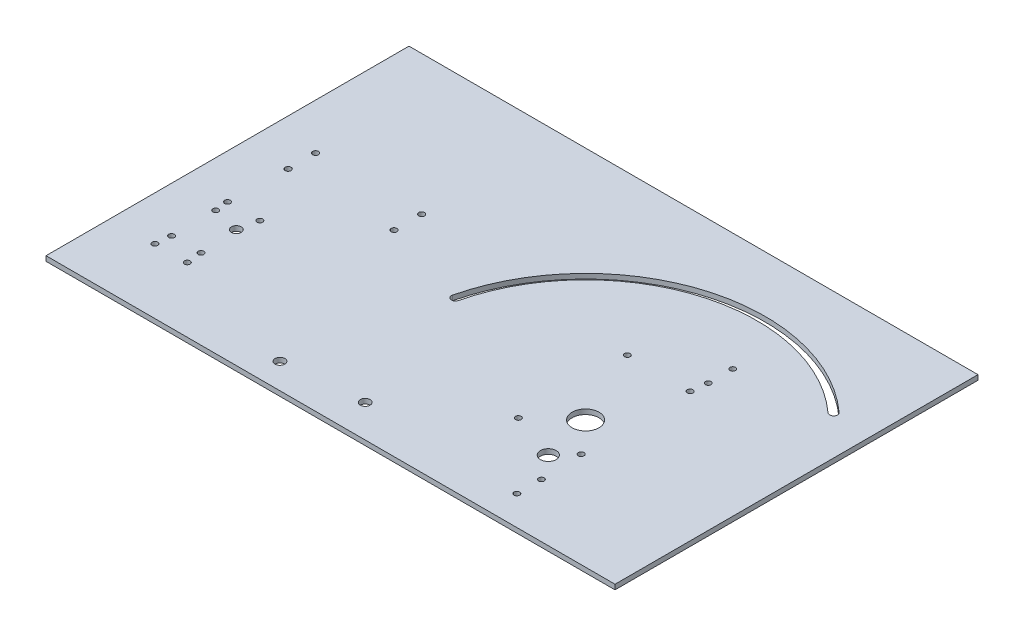
from build123d import *

# Parameters (mm, degrees)
SKETCH1_W           = 317.5
SKETCH1_H           = 177.8
SKETCH1_R           = 3.175
SKETCH1_R_2         = 8.73125
SKETCH1_R_3         = 1.905
BOSS_EXTRUDE1_DEPTH = 3.175
SKETCH3_R           = 3.175
CUT_EXTRUDE2_DEPTH  = 182.974869488
SKETCH4_W           = 25.4
SKETCH4_H           = 177.8
CUT_EXTRUDE3_DEPTH  = 182.974869488
SKETCH5_R           = 5.08
CUT_EXTRUDE4_DEPTH  = 182.974869488
SKETCH6_R           = 1.8034
CUT_EXTRUDE5_DEPTH  = 182.974869488
SKETCH7_R           = 1.8415
CUT_EXTRUDE6_DEPTH  = 182.974869488
BOSS_EXTRUDE2_DEPTH = 3.175
CUT_EXTRUDE7_DEPTH  = 256.444486386


with BuildPart() as part:
    # Sketch1 → Boss-Extrude1 (new body)
    with BuildSketch(Plane(origin=(0, 0, 0), x_dir=(1, 0, 0), z_dir=(0, 1, 0))):
        Rectangle(SKETCH1_W, SKETCH1_H)
        with Locations(Location((-111.76, -12.7, 0), (0, 0, 270))):
            Circle(SKETCH1_R, mode=Mode.SUBTRACT)
        with Locations(Location((107.95, -6.35, 0), (0, 0, 270))):
            Circle(SKETCH1_R_2, mode=Mode.SUBTRACT)
        with Locations(Location((-129.032, 55.88, 0), (0, 0, 270))):
            Circle(SKETCH1_R_3, mode=Mode.SUBTRACT)
        with Locations(Location((-60.452, 55.88, 0), (0, 0, 270))):
            Circle(SKETCH1_R_3, mode=Mode.SUBTRACT)
        with Locations(Location((-129.032, 38.1, 0), (0, 0, 270))):
            Circle(SKETCH1_R_3, mode=Mode.SUBTRACT)
        with Locations(Location((-60.452, 38.1, 0), (0, 0, 270))):
            Circle(SKETCH1_R_3, mode=Mode.SUBTRACT)
    extrude(amount=BOSS_EXTRUDE1_DEPTH)

    # Sketch3 → Cut-Extrude2 (cut, through all)
    with BuildSketch(Plane(origin=(0, 0, 0), x_dir=(-1, 0, 0), z_dir=(0, -1, 0))):
        with Locations(Location((23.829539609, -72.39, 0), (0, 0, 90))):
            Circle(SKETCH3_R)
        with Locations(Location((-26.764302072, -67.818, 0), (0, 0, 90))):
            Circle(SKETCH3_R)
    extrude(amount=-CUT_EXTRUDE2_DEPTH, mode=Mode.SUBTRACT)

    # Sketch4 → Cut-Extrude3 (cut, through all)
    with BuildSketch(Plane(origin=(0, 3.175, 0), x_dir=(1, 0, 0), z_dir=(0, 1, 0))):
        with Locations((146.05, 0)):
            Rectangle(SKETCH4_W, SKETCH4_H)
    extrude(amount=-CUT_EXTRUDE3_DEPTH, mode=Mode.SUBTRACT)

    # Sketch5 → Cut-Extrude4 (cut, through all)
    with BuildSketch(Plane(origin=(0, 3.175, 0), x_dir=(1, 0, 0), z_dir=(0, 1, 0))):
        with Locations(Location((115.57, -38.1, 0), (0, 0, 270))):
            Circle(SKETCH5_R)
    extrude(amount=-CUT_EXTRUDE4_DEPTH, mode=Mode.SUBTRACT)

    # Sketch6 → Cut-Extrude5 (cut, through all)
    with BuildSketch(Plane.XZ):
        with Locations(Location((127, 69.85, 0), (0, 0, 270))):
            Circle(SKETCH6_R)
        with Locations(Location((127, 53.975, 0), (0, 0, 270))):
            Circle(SKETCH6_R)
        with Locations(Location((127, -53.975, 0), (0, 0, 270))):
            Circle(SKETCH6_R)
        with Locations(Location((127, -69.85, 0), (0, 0, 270))):
            Circle(SKETCH6_R)
    extrude(amount=-CUT_EXTRUDE5_DEPTH, mode=Mode.SUBTRACT)

    # Sketch7 → Cut-Extrude6 (cut, through all)
    with BuildSketch(Plane(origin=(0, 3.175, 0), x_dir=(1, 0, 0), z_dir=(0, 1, 0))):
        with Locations(Location((125.73, 43.4975, 0), (0, 0, 270))):
            Circle(SKETCH7_R)
        with Locations(Location((85.09, 43.4975, 0), (0, 0, 270))):
            Circle(SKETCH7_R)
        with Locations(Location((85.09, -26.9875, 0), (0, 0, 270))):
            Circle(SKETCH7_R)
        with Locations(Location((125.73, -26.9875, 0), (0, 0, 270))):
            Circle(SKETCH7_R)
        with Locations(Location((-130.175, -46.99, 0), (0, 0, 270))):
            Circle(SKETCH7_R)
        with Locations(Location((-109.22, -46.99, 0), (0, 0, 270))):
            Circle(SKETCH7_R)
        with Locations(Location((-129.2225, -37.1475, 0), (0, 0, 270))):
            Circle(SKETCH7_R)
        with Locations(Location((-110.1725, -37.1475, 0), (0, 0, 270))):
            Circle(SKETCH7_R)
        with Locations(Location((-129.2225, -8.5725, 0), (0, 0, 270))):
            Circle(SKETCH7_R)
        with Locations(Location((-130.175, 0, 0), (0, 0, 270))):
            Circle(SKETCH7_R)
        with Locations(Location((-109.22, 0, 0), (0, 0, 270))):
            Circle(SKETCH7_R)
    extrude(amount=-CUT_EXTRUDE6_DEPTH, mode=Mode.SUBTRACT)

    # Sketch8 → Boss-Extrude2 (add, through all)
    with BuildSketch(Plane.XZ):
        Polygon((133.35, 88.9), (133.35, -88.9), (-158.75, -88.9), (-158.75, -146.05), (209.55, -146.05), (209.55, 88.9), align=None)
    extrude(amount=-BOSS_EXTRUDE2_DEPTH)

    # Sketch9 → Cut-Extrude7 (cut, through all)
    with BuildSketch(Plane.XZ):
        with BuildLine():
            ThreePointArc((185.852793296, -79.875035933), (186.034700239, -76.287542398), (182.447206704, -76.105635455))
            ThreePointArc((182.447206704, -76.105635455), (74.993781285, -99.775648516), (-0.149958886, -19.401980777))
            ThreePointArc((-0.149958886, -19.401980777), (-3.209431792, -17.519741277), (-5.091671292, -20.579214184))
            ThreePointArc((-5.091671292, -20.579214184), (73.487211286, -104.627106734), (185.852793296, -79.875035933))
        make_face()
    extrude(amount=-CUT_EXTRUDE7_DEPTH, mode=Mode.SUBTRACT)


solid = part.part
